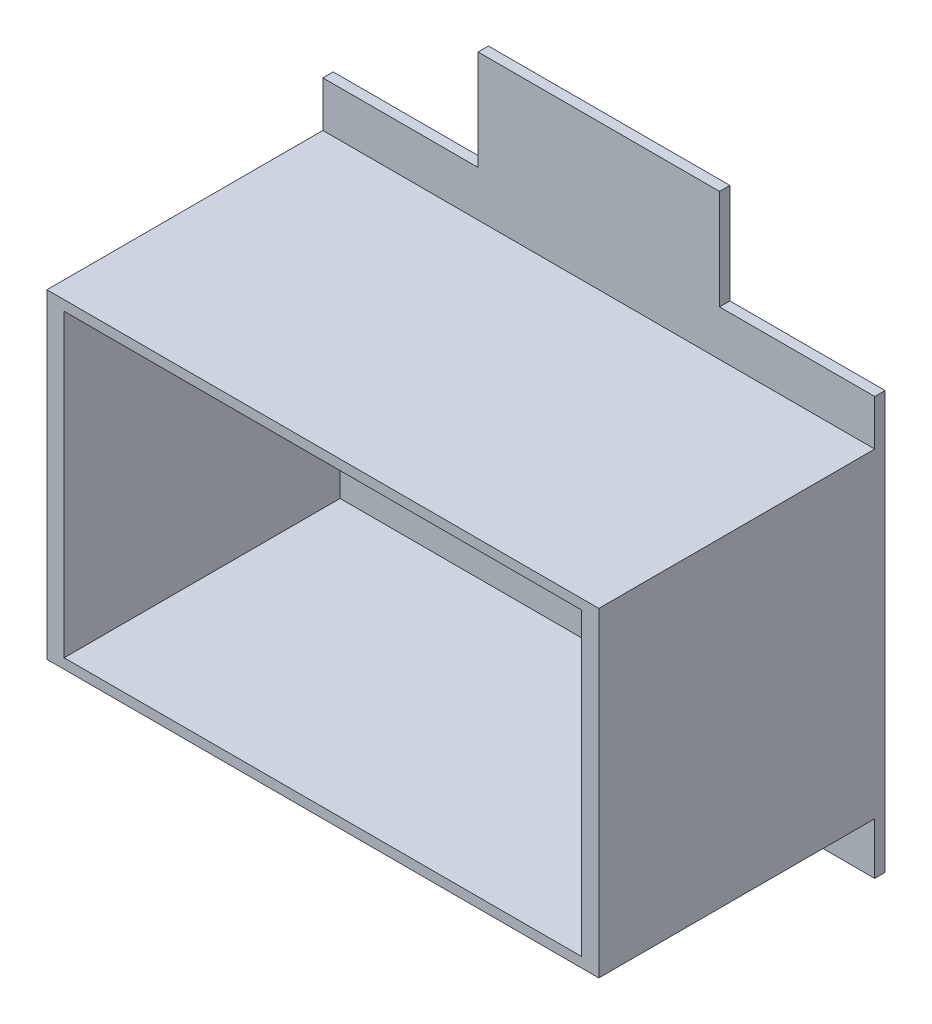
from build123d import *

# Parameters (mm, degrees)
SKETCH_1_W          = 160
SKETCH_1_H          = 150
EXTRUDE_1_DEPTH     = 3
SKETCH_2_W          = 160
SKETCH_2_H          = 92.8
SKETCH_2_W_2        = 150
SKETCH_2_H_2        = 87
EXTRUDE_2_DEPTH     = 80
SKETCH_4_W          = 45
SKETCH_4_H          = 29
CUT_EXTRUDE_2_DEPTH = 3


with BuildPart() as part:
    # ｽｹｯﾁ1 → ﾎﾞｽ - 押し出し1 (new body)
    with BuildSketch(Plane.XY):
        Rectangle(SKETCH_1_W, SKETCH_1_H)
    extrude(amount=EXTRUDE_1_DEPTH)

    # ｽｹｯﾁ2 → ﾎﾞｽ - 押し出し2 (add)
    with BuildSketch(Plane.XY.offset(3)):
        with Locations((0, -13.6)):
            Rectangle(SKETCH_2_W, SKETCH_2_H)
        with Locations((0, -13.6)):
            Rectangle(SKETCH_2_W_2, SKETCH_2_H_2, mode=Mode.SUBTRACT)
    extrude(amount=EXTRUDE_2_DEPTH)

    # ｽｹｯﾁ4 → ｶｯﾄ - 押し出し2 (cut)
    with BuildSketch(Plane.XY.offset(3)):
        with Locations((-57.5, 60.5)):
            Rectangle(SKETCH_4_W, SKETCH_4_H)
        with Locations((57.5, 60.5)):
            Rectangle(SKETCH_4_W, SKETCH_4_H)
    extrude(amount=-CUT_EXTRUDE_2_DEPTH, mode=Mode.SUBTRACT)


solid = part.part
